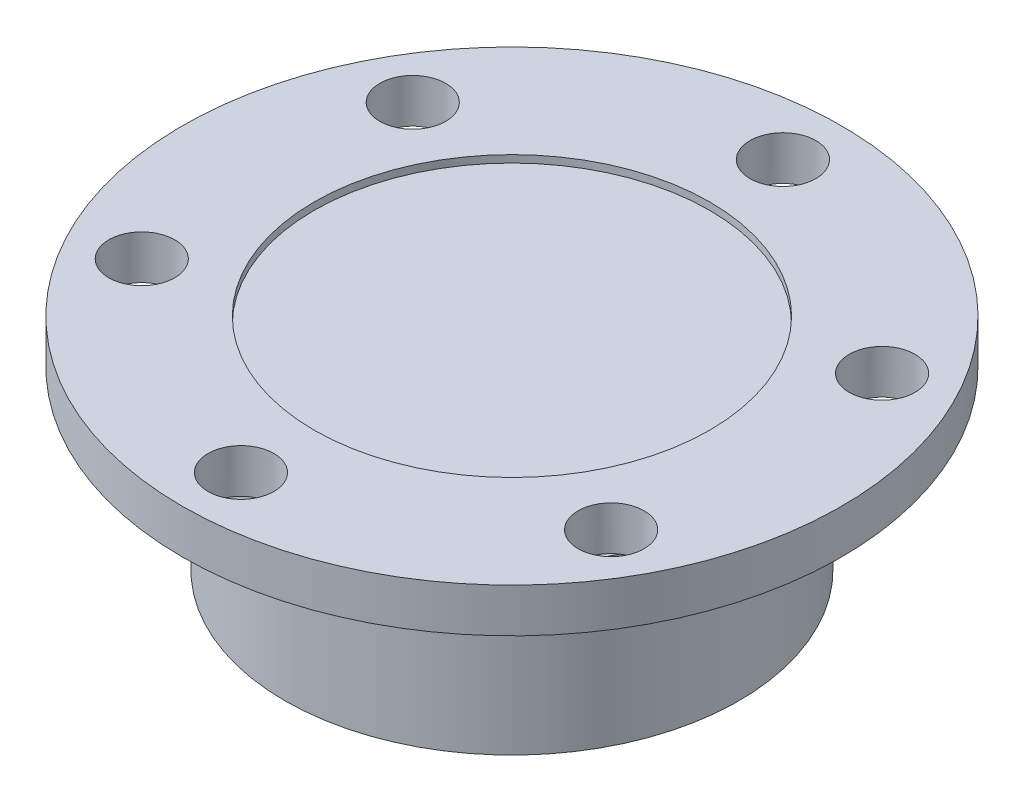
from build123d import *

# Parameters (mm, degrees)
CUT_EXTRUDE1_REACH = 72.356
SKETCH2_R          = 4.5


with BuildPart() as part:
    # Sketch1 → Revolve1 (revolve)
    with BuildSketch(Plane.XY, mode=Mode.PRIVATE) as revolve1_sk:
        Polygon((-45, 30), (-45, 24), (-29.5, 24), (-29.5, 22.5), (-31, 22.5), (-31, 0), (-26.672664989, 0), (-22, 26.5), (0, 26.5), (0, 29), (-27, 29), (-27, 30), align=None)
    revolve(revolve1_sk.sketch.rotate(Axis((0, 30.618797564, 0), (0, -1, 0)), 270), axis=Axis((0, 30.618797564, 0), (0, -1, 0)))

    # Sketch2 → Cut-Extrude1 (cut, up to next)
    with BuildSketch(Plane(origin=(0, 30, 0), x_dir=(1, 0, 0), z_dir=(0, 1, 0)), mode=Mode.PRIVATE) as cut_extrude1_sk1:
        with Locations(Location((0, 37, 0), (0, 0, 270))):
            Circle(SKETCH2_R)
    cut_extrude1_tool1 = extrude(cut_extrude1_sk1.sketch, amount=-CUT_EXTRUDE1_REACH, mode=Mode.PRIVATE) & part.part
    # Sketch2 → Cut-Extrude1 (cut, up to next)
    with BuildSketch(Plane(origin=(0, 30, 0), x_dir=(1, 0, 0), z_dir=(0, 1, 0)), mode=Mode.PRIVATE) as cut_extrude1_sk2:
        with Locations(Location((32.04293994, 18.5, 0), (0, 0, 270))):
            Circle(SKETCH2_R)
    cut_extrude1_tool2 = extrude(cut_extrude1_sk2.sketch, amount=-CUT_EXTRUDE1_REACH, mode=Mode.PRIVATE) & part.part
    # Sketch2 → Cut-Extrude1 (cut, up to next)
    with BuildSketch(Plane(origin=(0, 30, 0), x_dir=(1, 0, 0), z_dir=(0, 1, 0)), mode=Mode.PRIVATE) as cut_extrude1_sk3:
        with Locations(Location((32.04293994, -18.5, 0), (0, 0, 270))):
            Circle(SKETCH2_R)
    cut_extrude1_tool3 = extrude(cut_extrude1_sk3.sketch, amount=-CUT_EXTRUDE1_REACH, mode=Mode.PRIVATE) & part.part
    # Sketch2 → Cut-Extrude1 (cut, up to next)
    with BuildSketch(Plane(origin=(0, 30, 0), x_dir=(1, 0, 0), z_dir=(0, 1, 0)), mode=Mode.PRIVATE) as cut_extrude1_sk4:
        with Locations(Location((0, -37, 0), (0, 0, 270))):
            Circle(SKETCH2_R)
    cut_extrude1_tool4 = extrude(cut_extrude1_sk4.sketch, amount=-CUT_EXTRUDE1_REACH, mode=Mode.PRIVATE) & part.part
    # Sketch2 → Cut-Extrude1 (cut, up to next)
    with BuildSketch(Plane(origin=(0, 30, 0), x_dir=(1, 0, 0), z_dir=(0, 1, 0)), mode=Mode.PRIVATE) as cut_extrude1_sk5:
        with Locations(Location((-32.04293994, -18.5, 0), (0, 0, 270))):
            Circle(SKETCH2_R)
    cut_extrude1_tool5 = extrude(cut_extrude1_sk5.sketch, amount=-CUT_EXTRUDE1_REACH, mode=Mode.PRIVATE) & part.part
    # Sketch2 → Cut-Extrude1 (cut, up to next)
    with BuildSketch(Plane(origin=(0, 30, 0), x_dir=(1, 0, 0), z_dir=(0, 1, 0)), mode=Mode.PRIVATE) as cut_extrude1_sk6:
        with Locations(Location((-32.04293994, 18.5, 0), (0, 0, 270))):
            Circle(SKETCH2_R)
    cut_extrude1_tool6 = extrude(cut_extrude1_sk6.sketch, amount=-CUT_EXTRUDE1_REACH, mode=Mode.PRIVATE) & part.part
    add(cut_extrude1_tool1.solids().sort_by_distance((0, 30, -37))[0], mode=Mode.SUBTRACT)
    add(cut_extrude1_tool2.solids().sort_by_distance((32.04294, 30, -18.5))[0], mode=Mode.SUBTRACT)
    add(cut_extrude1_tool3.solids().sort_by_distance((32.04294, 30, 18.5))[0], mode=Mode.SUBTRACT)
    add(cut_extrude1_tool4.solids().sort_by_distance((0, 30, 37))[0], mode=Mode.SUBTRACT)
    add(cut_extrude1_tool5.solids().sort_by_distance((-32.04294, 30, 18.5))[0], mode=Mode.SUBTRACT)
    add(cut_extrude1_tool6.solids().sort_by_distance((-32.04294, 30, -18.5))[0], mode=Mode.SUBTRACT)


solid = part.part
